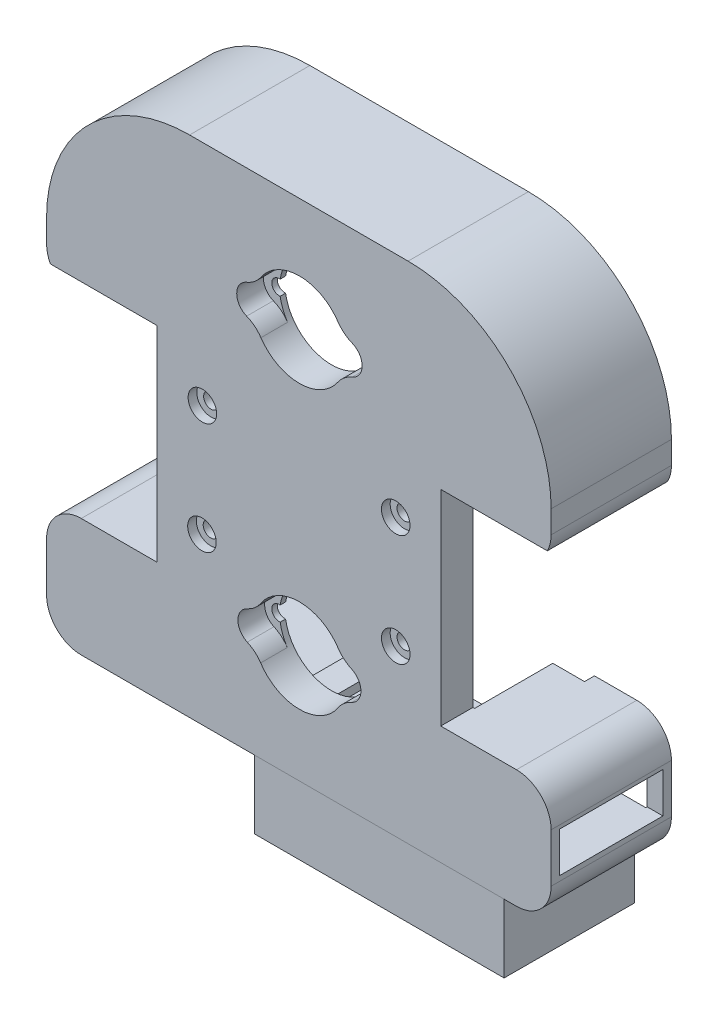
from build123d import *

# Parameters (mm, degrees)
BOSS_EXTRUDE1_DEPTH      = 17.78
CUT_EXTRUDE1_DEPTH       = 12.6
BOSS_EXTRUDE2_DEPTH      = 1.6
BOSS_EXTRUDE2_DEPTH_BACK = 17.78
CUT_EXTRUDE2_REACH       = 92.704
SKETCH8_W                = 23.622
SKETCH8_H                = 33.02
SKETCH16_W               = 35.2
SKETCH16_H               = 1.685330832
SKETCH16_W_2             = 4.602397166
SKETCH16_H_2             = 1.333724083
BOSS_EXTRUDE4_DEPTH      = 12.5
SKETCH15_R               = 1.6002
CUT_EXTRUDE5_DEPTH       = 14
CUT_EXTRUDE6_DEPTH       = 91.703812489
CUT_EXTRUDE6_DEPTH_BACK  = 91.703812489
SKETCH18_R               = 1.2
BOSS_EXTRUDE9_DEPTH      = 11
SKETCH40_W               = 35.5
SKETCH40_H               = 10.843264868
CUT_EXTRUDE14_DEPTH      = 20.5
SKETCH41_R               = 2.3
CUT_EXTRUDE15_DEPTH      = 1.4
SKETCH43_R               = 7.5
CUT_EXTRUDE16_DEPTH      = 11
SKETCH44_W               = 16.851669404
SKETCH44_H               = 6.338017253
CUT_EXTRUDE17_DEPTH      = 10
SKETCH45_W               = 16.621001534
SKETCH45_H               = 6.486365802
CUT_EXTRUDE18_DEPTH      = 10
SKETCH43_4_R             = 2.55
CUT_EXTRUDE19_DEPTH      = 4.3
FILLET1_R                = 5.08
FILLET2_R                = 5.08
FILLET4_R                = 5.08


with BuildPart() as part:
    # Sketch1 → Boss-Extrude1 (new body)
    with BuildSketch(Plane.XY.offset(2.54)):
        with BuildLine():
            Line((-35.052, 0), (35.052, 0))
            ThreePointArc((35.052, 0), (37.207261469, 0.892738531), (38.1, 3.048))
            Line((38.1, 3.048), (38.1, 10.922))
            ThreePointArc((38.1, 10.922), (37.207261469, 13.077261469), (35.052, 13.97))
            Line((35.052, 13.97), (31.242, 13.97))
            ThreePointArc((31.242, 13.97), (29.086738531, 14.862738531), (28.194, 17.018))
            Line((28.194, 17.018), (28.194, 45.974))
            ThreePointArc((28.194, 45.974), (29.086738531, 48.129261469), (31.242, 49.022))
            Line((31.242, 49.022), (35.052, 49.022))
            ThreePointArc((35.052, 49.022), (37.207261469, 49.914738531), (38.1, 52.07))
            Line((38.1, 52.07), (38.1, 55.7))
            ThreePointArc((38.1, 55.7), (32.095689014, 70.195689014), (17.6, 76.2))
            Line((17.6, 76.2), (-17.6, 76.2))
            ThreePointArc((-17.6, 76.2), (-32.095689014, 70.195689014), (-38.1, 55.7))
            Line((-38.1, 55.7), (-38.1, 52.07))
            ThreePointArc((-38.1, 52.07), (-37.207261469, 49.914738531), (-35.052, 49.022))
            Line((-35.052, 49.022), (-31.242, 49.022))
            ThreePointArc((-31.242, 49.022), (-29.086738531, 48.129261469), (-28.194, 45.974))
            Line((-28.194, 45.974), (-28.194, 17.018))
            ThreePointArc((-28.194, 17.018), (-29.086738531, 14.862738531), (-31.242, 13.97))
            Line((-31.242, 13.97), (-35.052, 13.97))
            ThreePointArc((-35.052, 13.97), (-37.207261469, 13.077261469), (-38.1, 10.922))
            Line((-38.1, 10.922), (-38.1, 3.048))
            ThreePointArc((-38.1, 3.048), (-37.207261469, 0.892738531), (-35.052, 0))
        make_face()
    extrude(amount=-BOSS_EXTRUDE1_DEPTH)

    # Sketch2 → Cut-Extrude1 (cut)
    with BuildSketch(Plane(origin=(0, 0, -15.24), x_dir=(-1, 0, 0), z_dir=(0, 0, -1))):
        with BuildLine():
            Line((33.02, 54.102), (33.02, 55.7))
            ThreePointArc((33.02, 55.7), (28.503586566, 66.603586566), (17.6, 71.12))
            Line((17.6, 71.12), (-17.6, 71.12))
            ThreePointArc((-17.6, 71.12), (-28.503586566, 66.603586566), (-33.02, 55.7))
            Line((-33.02, 55.7), (-33.02, 54.102))
            Line((-33.02, 54.102), (-31.242, 54.102))
            ThreePointArc((-31.242, 54.102), (-25.494636083, 51.721363917), (-23.114, 45.974))
            Line((-23.114, 45.974), (-23.114, 17.018))
            ThreePointArc((-23.114, 17.018), (-25.494636083, 11.270636083), (-31.242, 8.89))
            Line((-31.242, 8.89), (-33.02, 8.89))
            Line((-33.02, 8.89), (-33.02, 5.08))
            Line((-33.02, 5.08), (33.02, 5.08))
            Line((33.02, 5.08), (33.02, 8.89))
            Line((33.02, 8.89), (31.242, 8.89))
            ThreePointArc((31.242, 8.89), (25.494636083, 11.270636083), (23.114, 17.018))
            Line((23.114, 17.018), (23.114, 45.974))
            ThreePointArc((23.114, 45.974), (25.494636083, 51.721363917), (31.242, 54.102))
            Line((31.242, 54.102), (33.02, 54.102))
        make_face()
    extrude(amount=-CUT_EXTRUDE1_DEPTH, mode=Mode.SUBTRACT)

    # Sketch7 → Boss-Extrude2 (add, two sides: drawn at the far end of the back side and taken through both)
    with BuildSketch(Plane(origin=(0, 0, -15.24), x_dir=(-1, 0, 0), z_dir=(0, 0, -1)).offset(-BOSS_EXTRUDE2_DEPTH_BACK)):
        with BuildLine():
            Line((17.6, 78.74), (-17.6, 78.74))
            ThreePointArc((-17.6, 78.74), (-33.891740239, 71.991740239), (-40.64, 55.7))
            Line((-40.64, 55.7), (-40.64, 52.07))
            ThreePointArc((-40.64, 52.07), (-39.003312693, 48.118687307), (-35.052, 46.482))
            Line((-35.052, 46.482), (-31.242, 46.482))
            ThreePointArc((-31.242, 46.482), (-30.882789755, 46.333210245), (-30.734, 45.974))
            Line((-30.734, 45.974), (-30.734, 17.018))
            ThreePointArc((-30.734, 17.018), (-30.882789755, 16.658789755), (-31.242, 16.51))
            Line((-31.242, 16.51), (-35.052, 16.51))
            ThreePointArc((-35.052, 16.51), (-39.003312693, 14.873312693), (-40.64, 10.922))
            Line((-40.64, 10.922), (-40.64, 3.048))
            ThreePointArc((-40.64, 3.048), (-39.003312693, -0.903312693), (-35.052, -2.54))
            Line((-35.052, -2.54), (35.052, -2.54))
            ThreePointArc((35.052, -2.54), (39.003312693, -0.903312693), (40.64, 3.048))
            Line((40.64, 3.048), (40.64, 10.922))
            ThreePointArc((40.64, 10.922), (39.003312693, 14.873312693), (35.052, 16.51))
            Line((35.052, 16.51), (31.242, 16.51))
            ThreePointArc((31.242, 16.51), (30.882789755, 16.658789755), (30.734, 17.018))
            Line((30.734, 17.018), (30.734, 45.974))
            ThreePointArc((30.734, 45.974), (30.882789755, 46.333210245), (31.242, 46.482))
            Line((31.242, 46.482), (35.052, 46.482))
            ThreePointArc((35.052, 46.482), (39.003312693, 48.118687307), (40.64, 52.07))
            Line((40.64, 52.07), (40.64, 55.7))
            ThreePointArc((40.64, 55.7), (33.891740239, 71.991740239), (17.6, 78.74))
        make_face()
        with BuildLine():
            ThreePointArc((-38.1, 52.07), (-37.207261469, 49.914738531), (-35.052, 49.022))
            Line((-35.052, 49.022), (-31.242, 49.022))
            ThreePointArc((-31.242, 49.022), (-29.086738531, 48.129261469), (-28.194, 45.974))
            Line((-28.194, 45.974), (-28.194, 17.018))
            ThreePointArc((-28.194, 17.018), (-29.086738531, 14.862738531), (-31.242, 13.97))
            Line((-31.242, 13.97), (-35.052, 13.97))
            ThreePointArc((-35.052, 13.97), (-37.207261469, 13.077261469), (-38.1, 10.922))
            Line((-38.1, 10.922), (-38.1, 3.048))
            ThreePointArc((-38.1, 3.048), (-37.207261469, 0.892738531), (-35.052, 0))
            Line((-35.052, 0), (35.052, 0))
            ThreePointArc((35.052, 0), (37.207261469, 0.892738531), (38.1, 3.048))
            Line((38.1, 3.048), (38.1, 10.922))
            ThreePointArc((38.1, 10.922), (37.207261469, 13.077261469), (35.052, 13.97))
            Line((35.052, 13.97), (31.242, 13.97))
            ThreePointArc((31.242, 13.97), (29.086738531, 14.862738531), (28.194, 17.018))
            Line((28.194, 17.018), (28.194, 45.974))
            ThreePointArc((28.194, 45.974), (29.086738531, 48.129261469), (31.242, 49.022))
            Line((31.242, 49.022), (35.052, 49.022))
            ThreePointArc((35.052, 49.022), (37.207261469, 49.914738531), (38.1, 52.07))
            Line((38.1, 52.07), (38.1, 55.7))
            ThreePointArc((38.1, 55.7), (32.095689014, 70.195689014), (17.6, 76.2))
            Line((17.6, 76.2), (-17.6, 76.2))
            ThreePointArc((-17.6, 76.2), (-32.095689014, 70.195689014), (-38.1, 55.7))
            Line((-38.1, 55.7), (-38.1, 52.07))
        make_face(mode=Mode.SUBTRACT)
    extrude(amount=BOSS_EXTRUDE2_DEPTH + BOSS_EXTRUDE2_DEPTH_BACK)

    # Cut-Extrude2: up to this face of the body (flat: up to its plane)
    cut_extrude2_end = Plane(part.part.faces().sort_by_distance((0, 37.497394706, 2.54))[0])
    # Sketch8 → Cut-Extrude2 (cut, up to the picked face)
    with BuildSketch(Plane(origin=(0, 0, -16.84), x_dir=(-1, 0, 0), z_dir=(0, 0, -1)), mode=Mode.PRIVATE) as cut_extrude2_sk1:
        with Locations((-34.671, 33.02)):
            Rectangle(SKETCH8_W, SKETCH8_H)
    cut_extrude2_tool1 = split(extrude(cut_extrude2_sk1.sketch, amount=-CUT_EXTRUDE2_REACH, mode=Mode.PRIVATE), bisect_by=cut_extrude2_end, keep=Keep.BOTH, mode=Mode.PRIVATE)
    # Sketch8 → Cut-Extrude2 (cut, up to the picked face)
    with BuildSketch(Plane(origin=(0, 0, -16.84), x_dir=(-1, 0, 0), z_dir=(0, 0, -1)), mode=Mode.PRIVATE) as cut_extrude2_sk2:
        with Locations((34.671, 33.02)):
            Rectangle(SKETCH8_W, SKETCH8_H)
    cut_extrude2_tool2 = split(extrude(cut_extrude2_sk2.sketch, amount=-CUT_EXTRUDE2_REACH, mode=Mode.PRIVATE), bisect_by=cut_extrude2_end, keep=Keep.BOTH, mode=Mode.PRIVATE)
    add(cut_extrude2_tool1.solids().sort_by(Axis((34.671, 33.02, -16.84), (0, 0, 1)))[0], mode=Mode.SUBTRACT)
    add(cut_extrude2_tool2.solids().sort_by(Axis((-34.671, 33.02, -16.84), (0, 0, 1)))[0], mode=Mode.SUBTRACT)

    # Sketch16 → Boss-Extrude4 (add)
    with BuildSketch(Plane(origin=(0, 0, -15.24), x_dir=(-1, 0, 0), z_dir=(0, 0, -1))):
        with Locations((0, 70.277334584)):
            Rectangle(SKETCH16_W, SKETCH16_H)
        with Locations((2.301198583, 5.746862042)):
            Rectangle(SKETCH16_W_2, SKETCH16_H_2)
    extrude(amount=-BOSS_EXTRUDE4_DEPTH)

    # Sketch15 → Cut-Extrude5 (cut)
    with BuildSketch(Plane(origin=(0, 0, -15.24), x_dir=(-1, 0, 0), z_dir=(0, 0, -1))):
        with Locations((-14.34277535, 72.122520508)):
            Circle(SKETCH15_R)
        with Locations((16.219104281, 72.231338791)):
            Circle(SKETCH15_R)
        with Locations((2.363984114, 4.329121046)):
            Circle(SKETCH15_R)
    extrude(amount=-CUT_EXTRUDE5_DEPTH, mode=Mode.SUBTRACT)

    # Sketch18 → Cut-Extrude6 (cut, two sides: drawn at the far end of the back side and taken through both)
    with BuildSketch(Plane.XY.offset(2.54).offset(-CUT_EXTRUDE6_DEPTH_BACK)):
        with Locations((-15.541494675, 42.006428644)):
            Circle(SKETCH18_R)
        with Locations((15.61, 42.006428644)):
            Circle(SKETCH18_R)
        with Locations((15.61, 24.02)):
            Circle(SKETCH18_R)
        with Locations((-15.61, 24.02)):
            Circle(SKETCH18_R)
        with Locations((-7.457405524, 60.421927849)):
            Circle(SKETCH18_R)
        with Locations((7.642594476, 60.421927849)):
            Circle(SKETCH18_R)
        with Locations((7.44733389, 14.957111113)):
            Circle(SKETCH18_R)
        with Locations((-7.457405524, 14.957111113)):
            Circle(SKETCH18_R)
    extrude(amount=CUT_EXTRUDE6_DEPTH + CUT_EXTRUDE6_DEPTH_BACK, mode=Mode.SUBTRACT)

    # Sketch41 → Cut-Extrude15 (cut)
    with BuildSketch(Plane.XY.offset(2.54)):
        with Locations((-15.541494675, 42.006428644)):
            Circle(SKETCH41_R)
        with Locations((15.61, 42.006428644)):
            Circle(SKETCH41_R)
        with Locations((-15.61, 24.02)):
            Circle(SKETCH41_R)
        with Locations((15.61, 24.02)):
            Circle(SKETCH41_R)
    extrude(amount=-CUT_EXTRUDE15_DEPTH, mode=Mode.SUBTRACT)

    # Sketch43 → Cut-Extrude16 (cut)
    with BuildSketch(Plane.XY.offset(2.54)):
        with Locations((0.092594476, 60.421927849)):
            Circle(SKETCH43_R)
        with Locations((0.092594476, 14.957111113)):
            Circle(SKETCH43_R)
    extrude(amount=-CUT_EXTRUDE16_DEPTH, mode=Mode.SUBTRACT)

    # Sketch44 → Cut-Extrude17 (cut)
    with BuildSketch(Plane.ZY.offset(40.64)):
        with Locations((-6.926620325, 7.132552665)):
            Rectangle(SKETCH44_W, SKETCH44_H)
    extrude(amount=-CUT_EXTRUDE17_DEPTH, mode=Mode.SUBTRACT)

    # Sketch45 → Cut-Extrude18 (cut)
    with BuildSketch(Plane(origin=(40.64, 0, 0), x_dir=(0, 0, -1), z_dir=(1, 0, 0))):
        with Locations((7.158031616, 7.091837427)):
            Rectangle(SKETCH45_W, SKETCH45_H)
    extrude(amount=-CUT_EXTRUDE18_DEPTH, mode=Mode.SUBTRACT)

    # Sketch43<4> → Cut-Extrude19 (cut)
    with BuildSketch(Plane.XY.offset(2.54)):
        with Locations((-7.457405524, 60.421927849)):
            Circle(SKETCH43_4_R)
        with Locations((7.642594476, 60.421927849)):
            Circle(SKETCH43_4_R)
        with Locations((-7.262144937, 14.957111113)):
            Circle(SKETCH43_4_R)
        with Locations((7.44733389, 14.957111113)):
            Circle(SKETCH43_4_R)
    extrude(amount=-CUT_EXTRUDE19_DEPTH, mode=Mode.SUBTRACT)

    # Fillet1
    fillet1_edges = [part.edges().sort_by_distance(p)[0] for p in [
        (-6.966778127, 17.489947161, 0.39),
        (-6.966778127, 12.424275065, 0.39),
    ]]
    fillet(fillet1_edges, radius=FILLET1_R)

    # Fillet2
    fillet2_edges = [part.edges().sort_by_distance(p)[0] for p in [
        (7.15196708, 12.424275065, 0.39),
        (7.15196708, 17.489947161, 0.39),
    ]]
    fillet(fillet2_edges, radius=FILLET2_R)

    # Fillet4
    fillet4_edges = [part.edges().sort_by_distance(p)[0] for p in [
        (7.1621309, 57.917600643, 0.39),
        (7.1621309, 62.926255054, 0.39),
        (-6.976941948, 62.926255054, 0.39),
        (-6.976941948, 57.917600643, 0.39),
    ]]
    fillet(fillet4_edges, radius=FILLET4_R)


with BuildPart() as body_2:
    # Sketch37 → Boss-Extrude9 (new body)
    with BuildSketch(Plane.XZ.offset(2.54)):
        Polygon((-7.127444227, 2.54), (-7.127444227, -18.459992735), (33.100833295, -18.459966878), (33.064364856, 2.54), align=None)
    extrude(amount=BOSS_EXTRUDE9_DEPTH)

    # Sketch40 → Cut-Extrude14 (cut)
    with BuildSketch(Plane(origin=(1.1865e-05, 0, -18.459988153), x_dir=(-0.9999999999997935, 0, -6.427349859900517e-07), z_dir=(6.427349859900517e-07, 0, -0.9999999999997935))):
        with Locations((-12.748554621, -6.673135124)):
            Rectangle(SKETCH40_W, SKETCH40_H)
    extrude(amount=-CUT_EXTRUDE14_DEPTH, mode=Mode.SUBTRACT)


solid = Compound([part.part, body_2.part])
